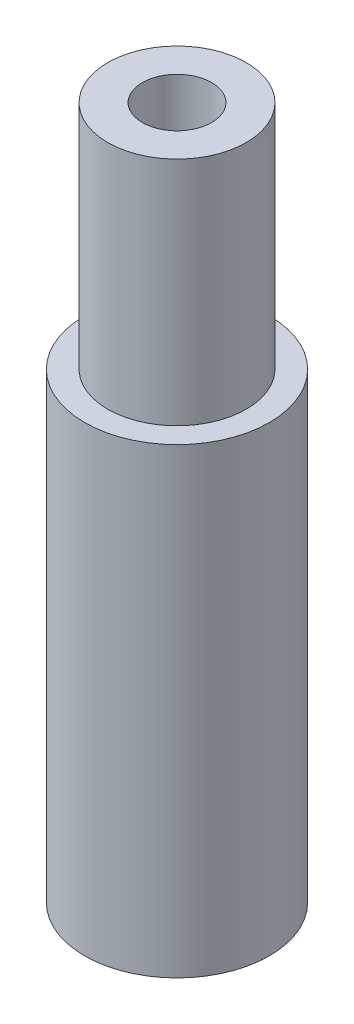
from build123d import *

# Parameters (mm, degrees)
SKETCH_1_R          = 4
EXTRUDE_1_DEPTH     = 20
SKETCH_2_R          = 3
EXTRUDE_2_DEPTH     = 10
SKETCH_3_R          = 1.5
CUT_EXTRUDE_1_DEPTH = 10


with BuildPart() as part:
    # 草图1 → 凸台-拉伸1 (new body)
    with BuildSketch(Plane(origin=(0, 0, 0), x_dir=(1, 0, 0), z_dir=(0, 1, 0))):
        with Locations(Location((0, 0, 0), (0, 0, 270))):
            Circle(SKETCH_1_R)
    extrude(amount=EXTRUDE_1_DEPTH)

    # 草图2 → 凸台-拉伸2 (add)
    with BuildSketch(Plane(origin=(0, 20, 0), x_dir=(1, 0, 0), z_dir=(0, 1, 0))):
        with Locations(Location((0, 0, 0), (0, 0, 270))):
            Circle(SKETCH_2_R)
    extrude(amount=EXTRUDE_2_DEPTH)

    # 草图3 → 切除-拉伸1 (cut)
    with BuildSketch(Plane(origin=(0, 30, 0), x_dir=(1, 0, 0), z_dir=(0, 1, 0))):
        with Locations(Location((0, 0, 0), (0, 0, 270))):
            Circle(SKETCH_3_R)
    extrude(amount=-CUT_EXTRUDE_1_DEPTH, mode=Mode.SUBTRACT)


solid = part.part
